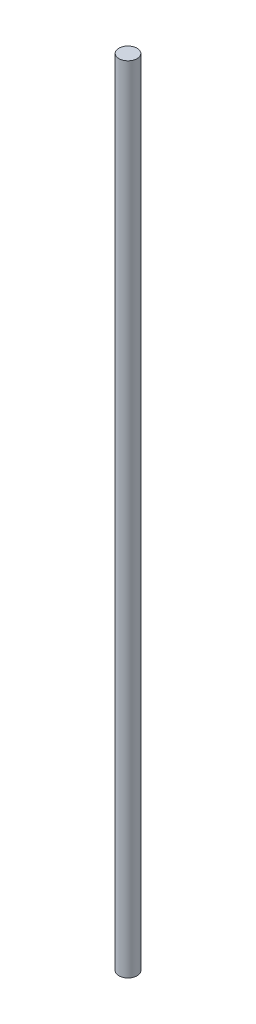
from build123d import *

# Parameters (mm, degrees)
SKETCH1_R           = 4
BOSS_EXTRUDE1_DEPTH = 350


with BuildPart() as part:
    # Sketch1 → Boss-Extrude1 (new body)
    with BuildSketch(Plane(origin=(0, 0, 0), x_dir=(1, 0, 0), z_dir=(0, 1, 0))):
        with Locations(Location((0, 0, 0), (0, 0, 270))):
            Circle(SKETCH1_R)
    extrude(amount=-BOSS_EXTRUDE1_DEPTH)


solid = part.part
